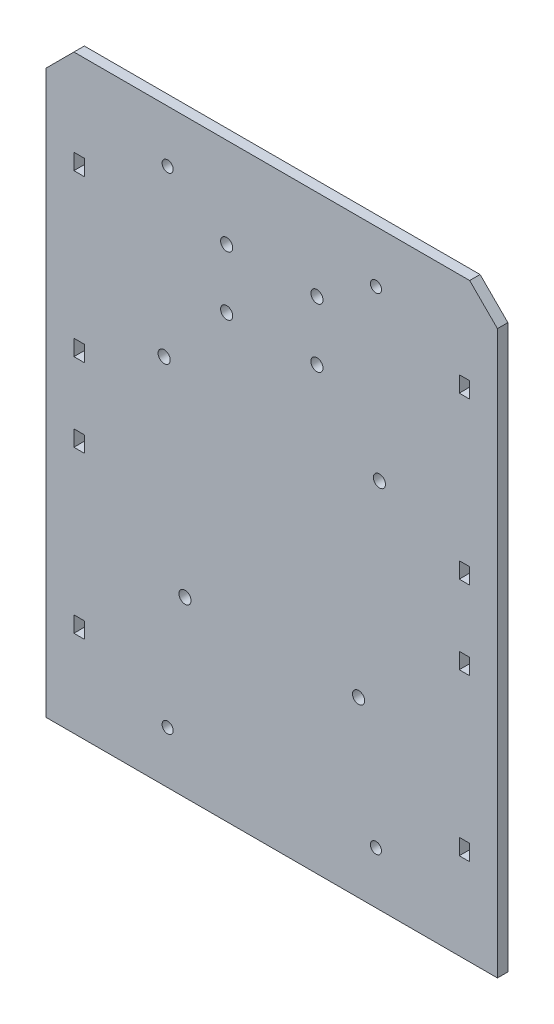
from build123d import *

# Parameters (mm, degrees)
SKETCH_1_R      = 1.6
SKETCH_1_R_2    = 1.75
SKETCH_1_W      = 3
SKETCH_1_H      = 4.6
EXTRUDE_1_DEPTH = 3


with BuildPart() as part:
    # ｽｹｯﾁ1 → ﾎﾞｽ - 押し出し1 (new body)
    with BuildSketch(Plane.XY):
        Polygon((0, 162), (8, 170), (122, 170), (130, 162), (130, 0), (0, 0), align=None)
        with Locations((35, 155)):
            Circle(SKETCH_1_R, mode=Mode.SUBTRACT)
        with Locations((95, 155)):
            Circle(SKETCH_1_R, mode=Mode.SUBTRACT)
        with Locations((35, 15)):
            Circle(SKETCH_1_R, mode=Mode.SUBTRACT)
        with Locations((95, 15)):
            Circle(SKETCH_1_R, mode=Mode.SUBTRACT)
        with Locations((34, 107)):
            Circle(SKETCH_1_R_2, mode=Mode.SUBTRACT)
        with Locations((96, 107)):
            Circle(SKETCH_1_R_2, mode=Mode.SUBTRACT)
        with Locations((40, 50)):
            Circle(SKETCH_1_R_2, mode=Mode.SUBTRACT)
        with Locations((90, 50)):
            Circle(SKETCH_1_R_2, mode=Mode.SUBTRACT)
        with Locations((52, 144)):
            Circle(SKETCH_1_R_2, mode=Mode.SUBTRACT)
        with Locations((78, 144)):
            Circle(SKETCH_1_R_2, mode=Mode.SUBTRACT)
        with Locations((52, 127)):
            Circle(SKETCH_1_R_2, mode=Mode.SUBTRACT)
        with Locations((78, 127)):
            Circle(SKETCH_1_R_2, mode=Mode.SUBTRACT)
        with Locations((9.5, 142.7)):
            Rectangle(SKETCH_1_W, SKETCH_1_H, mode=Mode.SUBTRACT)
        with Locations((120.5, 142.7)):
            Rectangle(SKETCH_1_W, SKETCH_1_H, mode=Mode.SUBTRACT)
        with Locations((9.5, 27.3)):
            Rectangle(SKETCH_1_W, SKETCH_1_H, mode=Mode.SUBTRACT)
        with Locations((120.5, 27.3)):
            Rectangle(SKETCH_1_W, SKETCH_1_H, mode=Mode.SUBTRACT)
        with Locations((9.5, 96.3)):
            Rectangle(SKETCH_1_W, SKETCH_1_H, mode=Mode.SUBTRACT)
        with Locations((120.5, 96.3)):
            Rectangle(SKETCH_1_W, SKETCH_1_H, mode=Mode.SUBTRACT)
        with Locations((9.5, 73.7)):
            Rectangle(SKETCH_1_W, SKETCH_1_H, mode=Mode.SUBTRACT)
        with Locations((120.5, 73.7)):
            Rectangle(SKETCH_1_W, SKETCH_1_H, mode=Mode.SUBTRACT)
    extrude(amount=EXTRUDE_1_DEPTH)


solid = part.part
